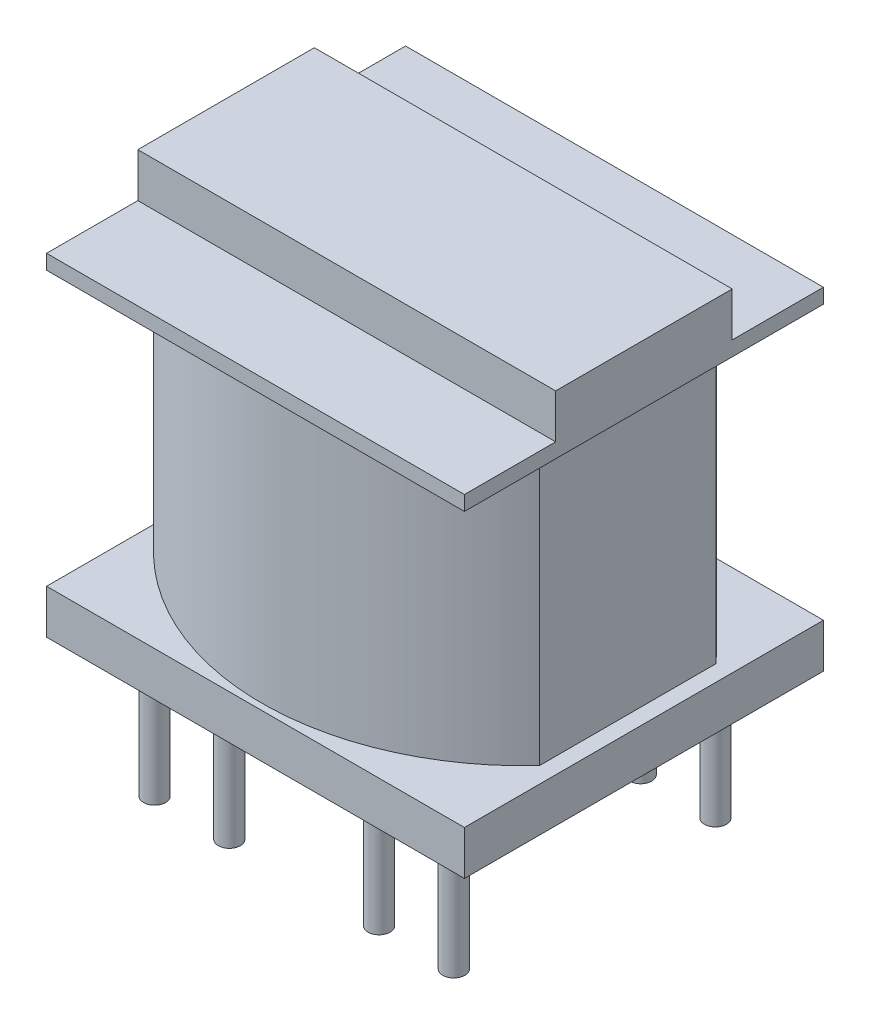
from build123d import *

# Parameters (mm, degrees)
SKETCH_1_W           = 14.2
SKETCH_1_H           = 12.2
EXTRUDE_1_DEPTH      = 12.8
SKETCH_2_OUTSIDE_W   = 20.736
SKETCH_2_OUTSIDE_H   = 18.736
SKETCH_2_OUTSIDE_W_2 = 19.736348523
SKETCH_2_OUTSIDE_H_2 = 6
CUT_EXTRUDE_1_DEPTH  = 1.5
SKETCH_3_OUTSIDE_W   = 20.736
SKETCH_3_OUTSIDE_H   = 18.736
CUT_EXTRUDE_2_DEPTH  = 9.3
SKETCH_4_R           = 0.375
EXTRUDE_2_DEPTH      = 4.5


with BuildPart() as part:
    # 草图1 → 凸台-拉伸1 (new body)
    with BuildSketch(Plane(origin=(0, 0, 0), x_dir=(1, 0, 0), z_dir=(0, 1, 0))):
        Rectangle(SKETCH_1_W, SKETCH_1_H)
    extrude(amount=EXTRUDE_1_DEPTH)

    # 草图2 outside → 切除-拉伸1 (cut)
    with BuildSketch(Plane(origin=(0, 12.8, 0), x_dir=(1, 0, 0), z_dir=(0, 1, 0))):
        Rectangle(SKETCH_2_OUTSIDE_W, SKETCH_2_OUTSIDE_H)
        with Locations((-0.320715663, 0)):
            Rectangle(SKETCH_2_OUTSIDE_W_2, SKETCH_2_OUTSIDE_H_2, mode=Mode.SUBTRACT)
    extrude(amount=-CUT_EXTRUDE_1_DEPTH, mode=Mode.SUBTRACT)

    # 草图3 outside → 切除-拉伸2 (cut)
    with BuildSketch(Plane(origin=(0, 1.5, 0), x_dir=(1, 0, 0), z_dir=(0, 1, 0))):
        Rectangle(SKETCH_3_OUTSIDE_W, SKETCH_3_OUTSIDE_H)
        with BuildLine():
            Line((-6.554198564, 3), (-6.554198564, -3))
            ThreePointArc((-6.554198564, -3), (0, -5.885804343), (6.554198564, -3))
            Line((6.554198564, -3), (6.554198564, 3))
            ThreePointArc((6.554198564, 3), (0, 5.885804343), (-6.554198564, 3))
        make_face(mode=Mode.SUBTRACT)
    extrude(amount=CUT_EXTRUDE_2_DEPTH, mode=Mode.SUBTRACT)

    # 草图4 → 凸台-拉伸2 (add)
    with BuildSketch(Plane.XZ):
        with Locations(Location((-5.085, 4.445, 0), (0, 0, 90))):
            Circle(SKETCH_4_R)
        with Locations(Location((-2.545, 4.445, 0), (0, 0, 90))):
            Circle(SKETCH_4_R)
        with Locations(Location((2.545, 4.445, 0), (0, 0, 90))):
            Circle(SKETCH_4_R)
        with Locations(Location((5.085, 4.445, 0), (0, 0, 90))):
            Circle(SKETCH_4_R)
        with Locations(Location((5.085, -4.445, 0), (0, 0, 90))):
            Circle(SKETCH_4_R)
        with Locations(Location((2.545, -4.445, 0), (0, 0, 90))):
            Circle(SKETCH_4_R)
        with Locations(Location((-2.545, -4.445, 0), (0, 0, 90))):
            Circle(SKETCH_4_R)
        with Locations(Location((-5.085, -4.445, 0), (0, 0, 90))):
            Circle(SKETCH_4_R)
    extrude(amount=EXTRUDE_2_DEPTH)


solid = part.part
